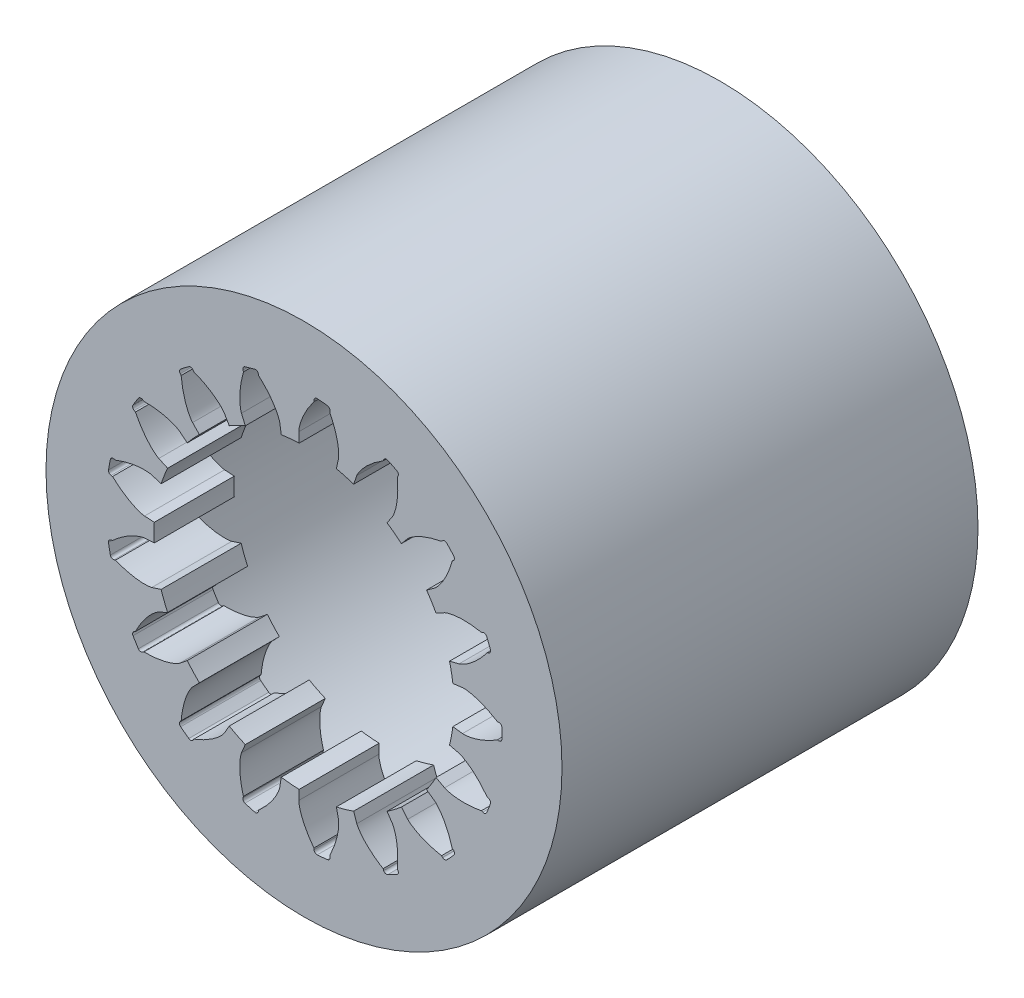
from build123d import *

# Parameters (mm, degrees)
BLANK_SKETCH_R    = 16.125
BLANK_SKETCH_R_2  = 9.375
BLANK_DEPTH       = 26
TOOTH_SPACE_DEPTH = 35.583684737
TEETH_COUNT       = 17
RELIEF_SKETCH_R   = 13
RELIEF_BORE_DEPTH = 8


with BuildPart() as part:
    # Blank Sketch → Blank (new body)
    with BuildSketch(Plane.XY):
        with Locations(Location((0, 0, 0), (0, 0, 180))):
            Circle(BLANK_SKETCH_R)
        with Locations(Location((0, 0, 0), (0, 0, 180))):
            Circle(BLANK_SKETCH_R_2, mode=Mode.SUBTRACT)
    extrude(amount=BLANK_DEPTH)

    # Tooth Space Sketch → Tooth Space (cut, symmetric)
    with BuildSketch(Plane.XY):
        with BuildLine():
            Line((9.906394479, 1.244298557), (8.061655443, 1.012589016))
            Line((8.061655443, 1.012589016), (8.061655443, -1.012589016))
            Line((8.061655443, -1.012589016), (9.906394479, -1.244298557))
            add(Edge.make_bspline(
                [(9.906394479, -1.244298557), (9.909822466, -1.244678867), (9.919453909, -1.245591992), (9.937725474, -1.246711559), (9.967608143, -1.24767476), (10.005767032, -1.247631809), (10.05515288, -1.246116375), (10.113384098, -1.242453433), (10.177397458, -1.236460978), (10.247022519, -1.227820469), (10.316436794, -1.217326273), (10.385608734, -1.20511615), (10.45443124, -1.191383429), (10.537667717, -1.172898147), (10.637276342, -1.148161722), (10.753330944, -1.115517317), (10.884452767, -1.074099669), (11.017439011, -1.027216594), (11.147727349, -0.977252121), (11.278602336, -0.922396619), (11.404681884, -0.866223355), (11.534727097, -0.803440429), (11.654310491, -0.743227461), (11.787155577, -0.670904087), (11.894042593, -0.611113705), (12.003432915, -0.545329192), (12.056518977, -0.512719929), (12.083582473, -0.49580609)],
                knots=[0, 0, 0, 0, 0, 0.005376749, 0.015083688, 0.02853182, 0.04661014, 0.064854849, 0.092110525, 0.119476176, 0.146842496, 0.174208854, 0.201574956, 0.228941013, 0.256307345, 0.307035032, 0.361767352, 0.416499661, 0.471231937, 0.525964282, 0.580696616, 0.635428982, 0.690161387, 0.744893688, 0.799626082, 0.854358408, 0.909090915, 0.909090915, 0.909090915, 0.909090915, 0.909090915], degree=4))
            Line((12.083582473, -0.49580609), (12.175812475, -0.499590414))
            ThreePointArc((12.175812475, -0.499590414), (12.311592068, -0.449173271), (12.370937843, -0.317051867))
            ThreePointArc((12.370937843, -0.317051867), (12.375, 0), (12.370937843, 0.317051867))
            ThreePointArc((12.370937843, 0.317051867), (12.311592068, 0.449173271), (12.175812475, 0.499590414))
            Line((12.175812475, 0.499590414), (12.083582473, 0.49580609))
            add(Edge.make_bspline(
                [(9.906394479, 1.244298557), (9.909822466, 1.244678867), (9.919453909, 1.245591992), (9.937725474, 1.246711559), (9.967608143, 1.24767476), (10.005767032, 1.247631809), (10.05515288, 1.246116375), (10.113384098, 1.242453433), (10.177397458, 1.236460978), (10.247022519, 1.227820469), (10.316436794, 1.217326273), (10.385608734, 1.20511615), (10.45443124, 1.191383429), (10.537667717, 1.172898147), (10.637276342, 1.148161722), (10.753330944, 1.115517317), (10.884452767, 1.074099669), (11.017439011, 1.027216594), (11.147727349, 0.977252121), (11.278602336, 0.922396619), (11.404681884, 0.866223355), (11.534727097, 0.803440429), (11.654310491, 0.743227461), (11.787155577, 0.670904087), (11.894042593, 0.611113705), (12.003432915, 0.545329192), (12.056518977, 0.512719929), (12.083582473, 0.49580609)],
                knots=[0, 0, 0, 0, 0, 0.005376749, 0.015083688, 0.02853182, 0.04661014, 0.064854849, 0.092110525, 0.119476176, 0.146842496, 0.174208854, 0.201574956, 0.228941013, 0.256307345, 0.307035032, 0.361767352, 0.416499661, 0.471231937, 0.525964282, 0.580696616, 0.635428982, 0.690161387, 0.744893688, 0.799626082, 0.854358408, 0.909090915, 0.909090915, 0.909090915, 0.909090915, 0.909090915], degree=4))
        make_face()
    tooth_space = extrude(amount=TOOTH_SPACE_DEPTH, both=True, mode=Mode.SUBTRACT)

    # Teeth: Tooth Space ×17 about axis
    teeth_axis = Axis((0, 0, -1.30007105), (0, 0, 1))
    for i in range(1, TEETH_COUNT):
        add(tooth_space.rotate(teeth_axis, i * 360 / TEETH_COUNT), mode=Mode.SUBTRACT)

    # Relief Sketch → Relief Bore (cut, symmetric)
    with BuildSketch(Plane.XY.offset(13)):
        Circle(RELIEF_SKETCH_R)
    extrude(amount=RELIEF_BORE_DEPTH, both=True, mode=Mode.SUBTRACT)


solid = part.part
